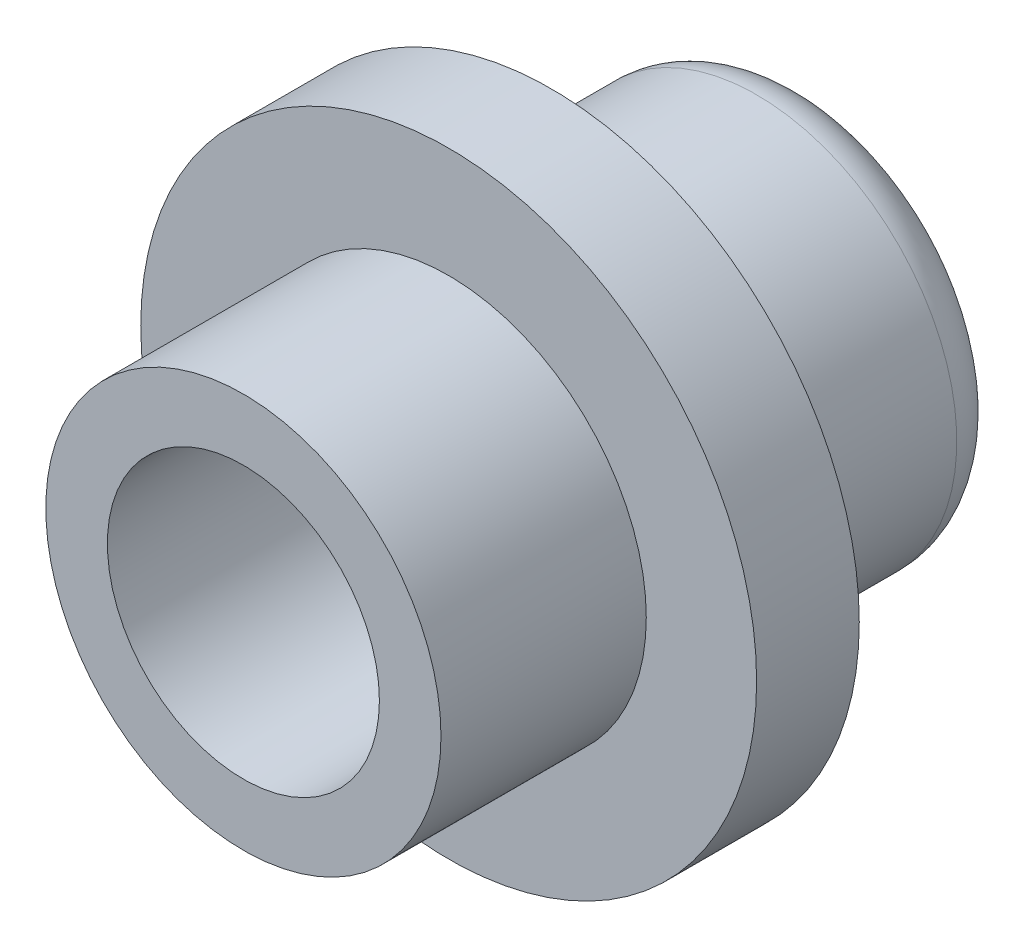
from build123d import *

# Parameters (mm, degrees)
SKETCH1_R           = 3.9
SKETCH1_R_2         = 2.65
BOSS_EXTRUDE1_DEPTH = 5
BOSS_EXTRUDE2_START = -2
SKETCH2_R           = 6
SKETCH2_R_2         = 2.65
BOSS_EXTRUDE2_DEPTH = 2
BOSS_EXTRUDE3_START = 2
SKETCH3_R           = 3.9
BOSS_EXTRUDE3_DEPTH = 2
FILLET1_R           = 1
SKETCH4_R           = 3.85
SKETCH4_R_2         = 2.65
BOSS_EXTRUDE4_DEPTH = 4


with BuildPart() as part:
    # Sketch1 → Boss-Extrude1 (new body)
    with BuildSketch(Plane.XY):
        Circle(SKETCH1_R)
        Circle(SKETCH1_R_2, mode=Mode.SUBTRACT)
    extrude(amount=BOSS_EXTRUDE1_DEPTH)

    # Sketch2 → Boss-Extrude2 (add)
    with BuildSketch(Plane.XY.offset(5).offset(BOSS_EXTRUDE2_START)):
        Circle(SKETCH2_R)
        Circle(SKETCH2_R_2, mode=Mode.SUBTRACT)
    extrude(amount=BOSS_EXTRUDE2_DEPTH)

    # Sketch3 → Boss-Extrude3 (add)
    with BuildSketch(Plane(origin=(0, 0, 0), x_dir=(-1, 0, 0), z_dir=(0, 0, -1)).offset(BOSS_EXTRUDE3_START)):
        Circle(SKETCH3_R)
    extrude(amount=-BOSS_EXTRUDE3_DEPTH)

    # Fillet1
    fillet1_edges = [part.edges().sort_by_distance(p)[0] for p in [
        (3.9, 0, -2),
    ]]
    fillet(fillet1_edges, radius=FILLET1_R)

    # Sketch4 → Boss-Extrude4 (add)
    with BuildSketch(Plane.XY.offset(5)):
        Circle(SKETCH4_R)
        Circle(SKETCH4_R_2, mode=Mode.SUBTRACT)
    extrude(amount=BOSS_EXTRUDE4_DEPTH)


solid = part.part
